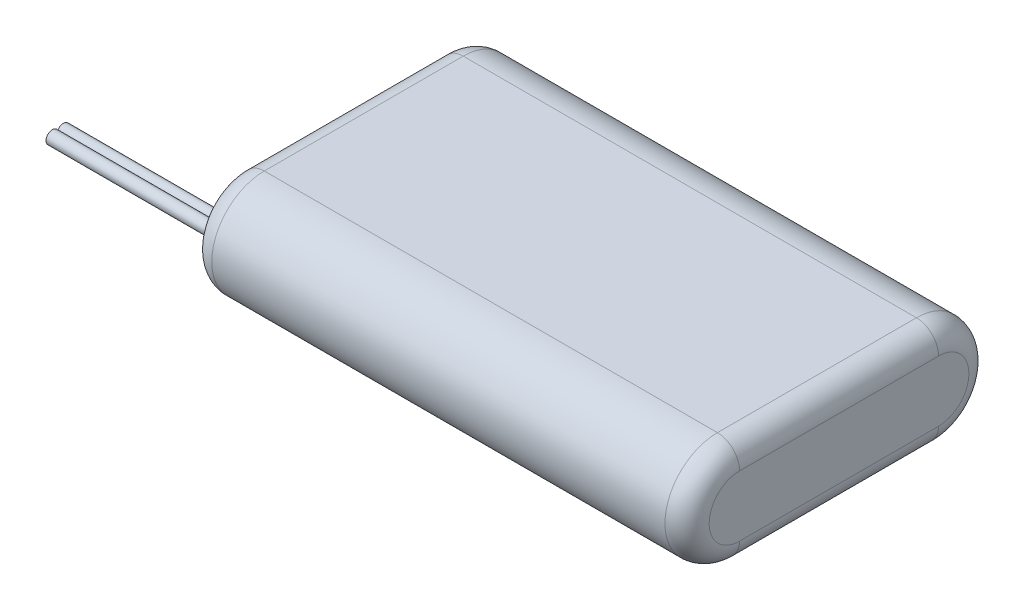
from build123d import *

# Parameters (mm, degrees)
BOSS_EXTRUDE1_DEPTH = 22.5
FILLET1_R           = 2
BOSS_EXTRUDE2_DEPTH = 15


with BuildPart() as part:
    # Sketch1 → Boss-Extrude1 (new, symmetric)
    with BuildSketch(Plane(origin=(0, 0, 0), x_dir=(0, 0, -1), z_dir=(1, 0, 0))):
        with BuildLine():
            Line((-9, 4.75), (9, 4.75))
            ThreePointArc((9, 4.75), (13.75, 0), (9, -4.75))
            Line((9, -4.75), (-9, -4.75))
            ThreePointArc((-9, -4.75), (-13.75, 0), (-9, 4.75))
        make_face()
    extrude(amount=BOSS_EXTRUDE1_DEPTH, both=True)

    # Fillet1
    fillet1_edges = [part.edges().sort_by_distance(p)[0] for p in [
        (22.5, 0, -13.75),
        (22.5, 4.75, 0),
        (22.5, 0, 13.75),
        (-22.5, 4.75, 0),
        (-22.5, 0, -13.75),
        (-22.5, -4.75, 0),
        (-22.5, 0, 13.75),
        (22.5, -4.75, 0),
    ]]
    fillet(fillet1_edges, radius=FILLET1_R)

    # Sketch2 → Boss-Extrude2 (add)
    with BuildSketch(Plane.ZY.offset(22.5)):
        with BuildLine():
            ThreePointArc((10.675, 0.283945417), (9.6, 0), (10.675, -0.283945417))
            ThreePointArc((10.675, -0.283945417), (11.75, 0), (10.675, 0.283945417))
        make_face()
    extrude(amount=BOSS_EXTRUDE2_DEPTH)


solid = part.part
